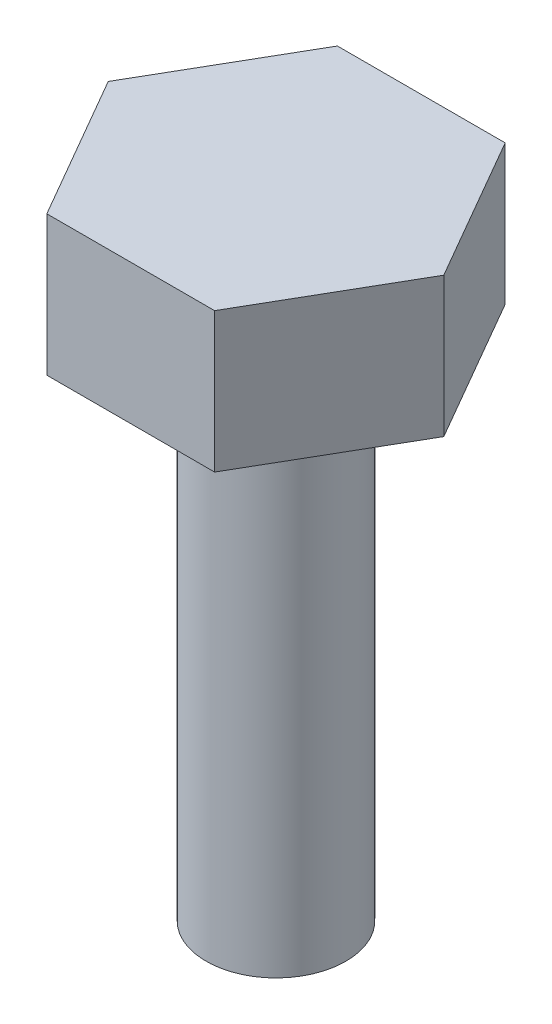
from build123d import *

# Parameters (mm, degrees)
BOSS_EXTRUDE1_DEPTH = 12.7
SKETCH2_R           = 6.35
BOSS_EXTRUDE2_DEPTH = 45.72


with BuildPart() as part:
    # Sketch1 → Boss-Extrude1 (new body)
    with BuildSketch(Plane(origin=(0, 0, 0), x_dir=(1, 0, 0), z_dir=(0, 1, 0))):
        Polygon((15.24, 0), (7.62, 13.198227154), (-7.62, 13.198227154), (-15.24, 0), (-7.62, -13.198227154), (7.62, -13.198227154), align=None)
    extrude(amount=BOSS_EXTRUDE1_DEPTH)

    # Sketch2 → Boss-Extrude2 (add)
    with BuildSketch(Plane.XZ):
        with Locations(Location((0, 0, 0), (0, 0, 270))):
            Circle(SKETCH2_R)
    extrude(amount=BOSS_EXTRUDE2_DEPTH)


solid = part.part
